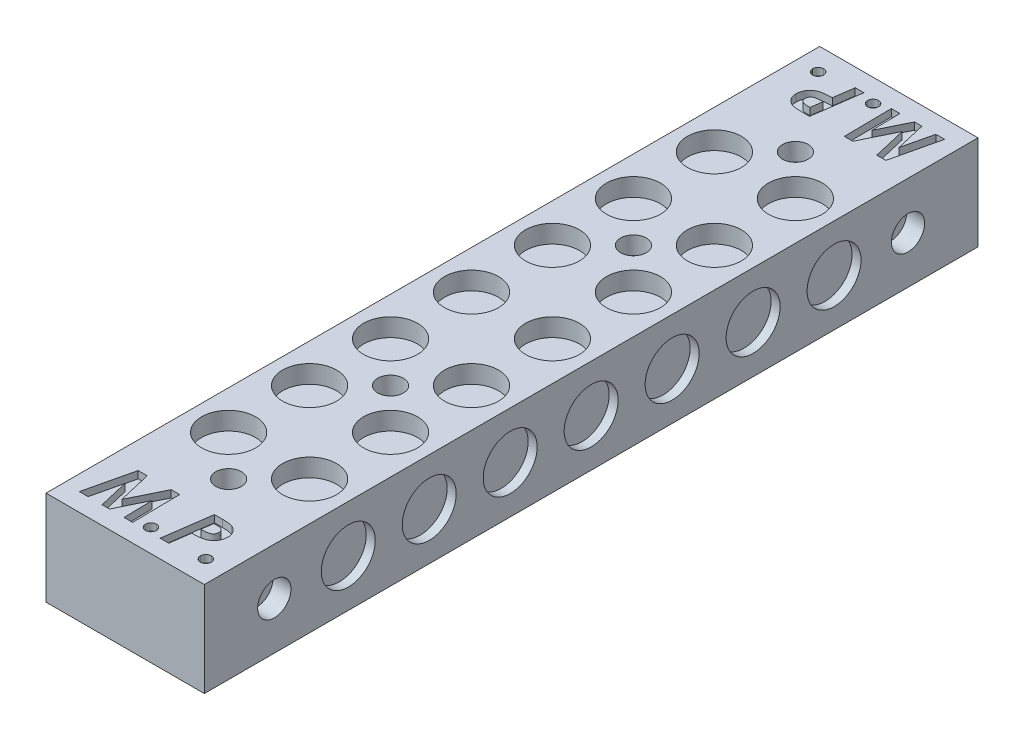
from build123d import *

# Parameters (mm, degrees)
SKETCH1_W           = 17.6
SKETCH1_H           = 86
SKETCH1_R           = 1.425
SKETCH1_R_2         = 3
BOSS_EXTRUDE1_DEPTH = 5.25
CUT_EXTRUDE2_REACH  = 48.758
SKETCH4_R           = 1.85
CUT_EXTRUDE4_REACH  = 48.758
SKETCH4_3_R         = 3
BOSS_EXTRUDE2_START = -10.5
SKETCH5_R           = 1.425
BOSS_EXTRUDE2_DEPTH = 10.5
BOSS_EXTRUDE3_START = -2
BOSS_EXTRUDE3_DEPTH = 6.5
CUT_EXTRUDE6_DEPTH  = 0.8
CIRPATTERN1_COUNT   = 2
CIRPATTERN1_ANGLE   = 180


with BuildPart() as part:
    # Sketch1 → Boss-Extrude1 (new, symmetric)
    with BuildSketch(Plane(origin=(0, 0, 0), x_dir=(1, 0, 0), z_dir=(0, 1, 0))):
        Rectangle(SKETCH1_W, SKETCH1_H)
        with Locations(Location((0, 31.5, 0), (0, 0, 90))):
            Circle(SKETCH1_R, mode=Mode.SUBTRACT)
        with Locations(Location((0, 22.5, 0), (0, 0, 90))):
            Circle(SKETCH1_R, mode=Mode.SUBTRACT)
        with Locations(Location((0, 13.5, 0), (0, 0, 90))):
            Circle(SKETCH1_R, mode=Mode.SUBTRACT)
        with Locations(Location((0, 4.5, 0), (0, 0, 90))):
            Circle(SKETCH1_R, mode=Mode.SUBTRACT)
        with Locations(Location((0, -4.5, 0), (0, 0, 90))):
            Circle(SKETCH1_R, mode=Mode.SUBTRACT)
        with Locations(Location((0, -13.5, 0), (0, 0, 90))):
            Circle(SKETCH1_R, mode=Mode.SUBTRACT)
        with Locations(Location((0, -22.5, 0), (0, 0, 90))):
            Circle(SKETCH1_R, mode=Mode.SUBTRACT)
        with Locations(Location((0, -31.5, 0), (0, 0, 90))):
            Circle(SKETCH1_R, mode=Mode.SUBTRACT)
        with Locations(Location((-4.5, -27, 0), (0, 0, 90))):
            Circle(SKETCH1_R_2, mode=Mode.SUBTRACT)
        with Locations(Location((-4.5, -18, 0), (0, 0, 90))):
            Circle(SKETCH1_R_2, mode=Mode.SUBTRACT)
        with Locations(Location((-4.5, -9, 0), (0, 0, 90))):
            Circle(SKETCH1_R_2, mode=Mode.SUBTRACT)
        with Locations(Location((-4.5, 0, 0), (0, 0, 90))):
            Circle(SKETCH1_R_2, mode=Mode.SUBTRACT)
        with Locations(Location((-4.5, 9, 0), (0, 0, 90))):
            Circle(SKETCH1_R_2, mode=Mode.SUBTRACT)
        with Locations(Location((-4.5, 18, 0), (0, 0, 90))):
            Circle(SKETCH1_R_2, mode=Mode.SUBTRACT)
        with Locations(Location((-4.5, 27, 0), (0, 0, 90))):
            Circle(SKETCH1_R_2, mode=Mode.SUBTRACT)
        with Locations(Location((4.5, 27, 0), (0, 0, 90))):
            Circle(SKETCH1_R_2, mode=Mode.SUBTRACT)
        with Locations(Location((4.5, -27, 0), (0, 0, 90))):
            Circle(SKETCH1_R_2, mode=Mode.SUBTRACT)
        with Locations(Location((4.5, -18, 0), (0, 0, 90))):
            Circle(SKETCH1_R_2, mode=Mode.SUBTRACT)
        with Locations(Location((4.5, -9, 0), (0, 0, 90))):
            Circle(SKETCH1_R_2, mode=Mode.SUBTRACT)
        with Locations(Location((4.5, 0, 0), (0, 0, 90))):
            Circle(SKETCH1_R_2, mode=Mode.SUBTRACT)
        with Locations(Location((4.5, 9, 0), (0, 0, 90))):
            Circle(SKETCH1_R_2, mode=Mode.SUBTRACT)
        with Locations(Location((4.5, 18, 0), (0, 0, 90))):
            Circle(SKETCH1_R_2, mode=Mode.SUBTRACT)
    extrude(amount=BOSS_EXTRUDE1_DEPTH, both=True)

    # Sketch4 → Cut-Extrude2 (cut, up to next)
    with BuildSketch(Plane(origin=(8.8, 0, 0), x_dir=(0, 0, -1), z_dir=(1, 0, 0)), mode=Mode.PRIVATE) as cut_extrude2_sk1:
        with Locations((-35.22, 0)):
            Circle(SKETCH4_R)
    cut_extrude2_tool1 = extrude(cut_extrude2_sk1.sketch, amount=-CUT_EXTRUDE2_REACH, mode=Mode.PRIVATE) & part.part
    # Sketch4 → Cut-Extrude2 (cut, up to next)
    with BuildSketch(Plane(origin=(8.8, 0, 0), x_dir=(0, 0, -1), z_dir=(1, 0, 0)), mode=Mode.PRIVATE) as cut_extrude2_sk2:
        with Locations((35.22, 0)):
            Circle(SKETCH4_R)
    cut_extrude2_tool2 = extrude(cut_extrude2_sk2.sketch, amount=-CUT_EXTRUDE2_REACH, mode=Mode.PRIVATE) & part.part
    add(cut_extrude2_tool1.solids().sort_by_distance((8.8, 0, 35.22))[0], mode=Mode.SUBTRACT)
    add(cut_extrude2_tool2.solids().sort_by_distance((8.8, 0, -35.22))[0], mode=Mode.SUBTRACT)

    # Sketch4<3> → Cut-Extrude4 (cut, up to next)
    with BuildSketch(Plane(origin=(8.8, 0, 0), x_dir=(0, 0, -1), z_dir=(1, 0, 0)), mode=Mode.PRIVATE) as cut_extrude4_sk1:
        with Locations((-27, 0)):
            Circle(SKETCH4_3_R)
    cut_extrude4_tool1 = extrude(cut_extrude4_sk1.sketch, amount=-CUT_EXTRUDE4_REACH, mode=Mode.PRIVATE) & part.part
    # Sketch4<3> → Cut-Extrude4 (cut, up to next)
    with BuildSketch(Plane(origin=(8.8, 0, 0), x_dir=(0, 0, -1), z_dir=(1, 0, 0)), mode=Mode.PRIVATE) as cut_extrude4_sk2:
        with Locations((-18, 0)):
            Circle(SKETCH4_3_R)
    cut_extrude4_tool2 = extrude(cut_extrude4_sk2.sketch, amount=-CUT_EXTRUDE4_REACH, mode=Mode.PRIVATE) & part.part
    # Sketch4<3> → Cut-Extrude4 (cut, up to next)
    with BuildSketch(Plane(origin=(8.8, 0, 0), x_dir=(0, 0, -1), z_dir=(1, 0, 0)), mode=Mode.PRIVATE) as cut_extrude4_sk3:
        with Locations((-9, 0)):
            Circle(SKETCH4_3_R)
    cut_extrude4_tool3 = extrude(cut_extrude4_sk3.sketch, amount=-CUT_EXTRUDE4_REACH, mode=Mode.PRIVATE) & part.part
    # Sketch4<3> → Cut-Extrude4 (cut, up to next)
    with BuildSketch(Plane(origin=(8.8, 0, 0), x_dir=(0, 0, -1), z_dir=(1, 0, 0)), mode=Mode.PRIVATE) as cut_extrude4_sk4:
        Circle(SKETCH4_3_R)
    cut_extrude4_tool4 = extrude(cut_extrude4_sk4.sketch, amount=-CUT_EXTRUDE4_REACH, mode=Mode.PRIVATE) & part.part
    # Sketch4<3> → Cut-Extrude4 (cut, up to next)
    with BuildSketch(Plane(origin=(8.8, 0, 0), x_dir=(0, 0, -1), z_dir=(1, 0, 0)), mode=Mode.PRIVATE) as cut_extrude4_sk5:
        with Locations((9, 0)):
            Circle(SKETCH4_3_R)
    cut_extrude4_tool5 = extrude(cut_extrude4_sk5.sketch, amount=-CUT_EXTRUDE4_REACH, mode=Mode.PRIVATE) & part.part
    # Sketch4<3> → Cut-Extrude4 (cut, up to next)
    with BuildSketch(Plane(origin=(8.8, 0, 0), x_dir=(0, 0, -1), z_dir=(1, 0, 0)), mode=Mode.PRIVATE) as cut_extrude4_sk6:
        with Locations((18, 0)):
            Circle(SKETCH4_3_R)
    cut_extrude4_tool6 = extrude(cut_extrude4_sk6.sketch, amount=-CUT_EXTRUDE4_REACH, mode=Mode.PRIVATE) & part.part
    # Sketch4<3> → Cut-Extrude4 (cut, up to next)
    with BuildSketch(Plane(origin=(8.8, 0, 0), x_dir=(0, 0, -1), z_dir=(1, 0, 0)), mode=Mode.PRIVATE) as cut_extrude4_sk7:
        with Locations((27, 0)):
            Circle(SKETCH4_3_R)
    cut_extrude4_tool7 = extrude(cut_extrude4_sk7.sketch, amount=-CUT_EXTRUDE4_REACH, mode=Mode.PRIVATE) & part.part
    cut_extrude4_1 = cut_extrude4_tool1.solids().sort_by_distance((8.8, 0, 27))[0]
    add(cut_extrude4_1, mode=Mode.SUBTRACT)
    cut_extrude4_2 = cut_extrude4_tool2.solids().sort_by_distance((8.8, 0, 18))[0]
    add(cut_extrude4_2, mode=Mode.SUBTRACT)
    cut_extrude4_3 = cut_extrude4_tool3.solids().sort_by_distance((8.8, 0, 9))[0]
    add(cut_extrude4_3, mode=Mode.SUBTRACT)
    cut_extrude4_4 = cut_extrude4_tool4.solids().sort_by_distance((8.8, 0, 0))[0]
    add(cut_extrude4_4, mode=Mode.SUBTRACT)
    cut_extrude4_5 = cut_extrude4_tool5.solids().sort_by_distance((8.8, 0, -9))[0]
    add(cut_extrude4_5, mode=Mode.SUBTRACT)
    cut_extrude4_6 = cut_extrude4_tool6.solids().sort_by_distance((8.8, 0, -18))[0]
    add(cut_extrude4_6, mode=Mode.SUBTRACT)
    cut_extrude4_7 = cut_extrude4_tool7.solids().sort_by_distance((8.8, 0, -27))[0]
    add(cut_extrude4_7, mode=Mode.SUBTRACT)
    cut_extrude4 = cut_extrude4_1 + cut_extrude4_2 + cut_extrude4_3 + cut_extrude4_4 + cut_extrude4_5 + cut_extrude4_6 + cut_extrude4_7  # Cut-Extrude4 as one shape, for the pattern or mirror that repeats it

    # Mirror3: Cut-Extrude4 across plane
    add(cut_extrude4.mirror(Plane(origin=(0, 0, 0), x_dir=(0, 0, 1), z_dir=(1, 0, 0))), mode=Mode.SUBTRACT)

    # Sketch5 → Boss-Extrude2 (add)
    with BuildSketch(Plane(origin=(0, 5.25, 0), x_dir=(1, 0, 0), z_dir=(0, 1, 0)).offset(BOSS_EXTRUDE2_START)):
        with Locations((0, -22.5)):
            Circle(SKETCH5_R)
        with Locations((0, -4.5)):
            Circle(SKETCH5_R)
        with Locations((0, 4.5)):
            Circle(SKETCH5_R)
        with Locations((0, 22.5)):
            Circle(SKETCH5_R)
    extrude(amount=BOSS_EXTRUDE2_DEPTH)

    # Sketch7 → Boss-Extrude3 (add)
    with BuildSketch(Plane.XZ.offset(5.25).offset(BOSS_EXTRUDE3_START)):
        Polygon((-7.8, -32), (-6.8, -32), (-6.8, -43), (6.8, -43), (6.8, -32), (7.8, -32), (7.8, 32), (6.8, 32), (6.8, 43), (-6.8, 43), (-6.8, 32), (-7.8, 32), align=None)
    extrude(amount=-BOSS_EXTRUDE3_DEPTH)

    # Sketch9 → Cut-Extrude6 (cut)
    # profile 1 of 4: a face of its own
    with BuildSketch(Plane(origin=(0, 5.25, 0), x_dir=(1, 0, 0), z_dir=(0, 1, 0))):
        Polygon((-5.848808093, -35.708333333), (-4.838600093, -35.708333333), (-3.981036325, -39.395115518), (-2.170506143, -35.708333333), (-1.233440171, -35.708333333), (-1.165598291, -41), (-2.115384615, -41), (-2.183226496, -37.83475227), (-3.737229567, -41), (-4.565112513, -41), (-5.337873932, -37.675747863), (-6.119115585, -41), (-7.092222556, -41), align=None)
    # profile 2 of 4: a face of its own
    with BuildSketch(Plane(origin=(0, 5.25, 0), x_dir=(1, 0, 0), z_dir=(0, 1, 0))):
        with BuildLine():
            add(Edge.make_bspline(
                [(0.326923077, -39.846688034), (0.367474829, -39.848437028), (0.447262654, -39.85187827), (0.56137115, -39.887855655), (0.667026619, -39.943864503), (0.759476329, -40.022260945), (0.838324474, -40.114860236), (0.89686432, -40.219695051), (0.930773602, -40.335791585), (0.935218177, -40.416057052), (0.9375, -40.457264957)],
                knots=[0, 0, 0, 0, 1.011829643, 1.990831015, 2.96394547, 3.98733706, 5.003945692, 5.993273531, 6.969756284, 8, 8, 8, 8], degree=3))
            add(Edge.make_bspline(
                [(0.9375, -40.457264957), (0.93515559, -40.497754574), (0.930550481, -40.577288066), (0.896921804, -40.692765191), (0.837978393, -40.797592524), (0.759923571, -40.891305562), (0.666642636, -40.969231036), (0.561902795, -41.027298713), (0.446960546, -41.060918569), (0.367417538, -41.065506311), (0.326923077, -41.06784188)],
                knots=[0, 0, 0, 0, 1.013694729, 1.991193998, 2.981551723, 4.006008661, 5.030465598, 6.008806002, 6.986305271, 8, 8, 8, 8], degree=3))
            add(Edge.make_bspline(
                [(0.326923077, -41.06784188), (0.286084058, -41.065492426), (0.205864139, -41.060877402), (0.090090381, -41.027551387), (-0.014870988, -40.969170343), (-0.108180764, -40.891609851), (-0.185299795, -40.797522839), (-0.242896926, -40.69249252), (-0.276763204, -40.57731624), (-0.281329298, -40.497764078), (-0.283653846, -40.457264957)],
                knots=[0, 0, 0, 0, 1.02155614, 2.006638561, 2.984070978, 4.007577129, 5.025452526, 6.010654007, 6.987246069, 8, 8, 8, 8], degree=3))
            add(Edge.make_bspline(
                [(-0.283653846, -40.457264957), (-0.281392423, -40.416047336), (-0.276987584, -40.335762942), (-0.242839317, -40.219967243), (-0.185643871, -40.114935146), (-0.107732558, -40.021952702), (-0.015254456, -39.943927112), (0.090621124, -39.88760313), (0.205563446, -39.851917123), (0.286026851, -39.848450152), (0.326923077, -39.846688034)],
                knots=[0, 0, 0, 0, 1.029295292, 2.004879113, 2.989063463, 3.999073543, 5.021523017, 5.993741641, 6.980301721, 8, 8, 8, 8], degree=3))
        make_face()
    # profile 3 of 4: a face of its own
    with BuildSketch(Plane(origin=(0, 5.25, 0), x_dir=(1, 0, 0), z_dir=(0, 1, 0))):
        with BuildLine():
            Line((2.629306891, -35.708333333), (3.534571982, -35.708333333))
            add(Edge.make_bspline(
                [(3.534571982, -35.708333333), (3.600656175, -35.708602478), (3.727923609, -35.709120806), (3.91136645, -35.716891255), (4.080020866, -35.728164628), (4.233470528, -35.743952635), (4.371684748, -35.763172455), (4.494258792, -35.789265491), (4.60273656, -35.817086524), (4.667959819, -35.843374615), (4.698484241, -35.855677417)],
                knots=[0, 0, 0, 0, 1.344208059, 2.588726621, 3.734329264, 4.782131975, 5.726482068, 6.570895881, 7.331180631, 8, 8, 8, 8], degree=3))
            add(Edge.make_bspline(
                [(4.698484241, -35.855677417), (4.732643973, -35.871090703), (4.79997519, -35.901471366), (4.895107764, -35.954615517), (4.983674092, -36.012425571), (5.066506171, -36.073624269), (5.142997924, -36.139555142), (5.213594367, -36.209687506), (5.277033404, -36.285160271), (5.334570538, -36.36481781), (5.385196843, -36.448674256), (5.430178569, -36.535523325), (5.466989165, -36.62620901), (5.498356451, -36.719833163), (5.521316431, -36.817864912), (5.537964362, -36.919157209), (5.549318195, -37.023927737), (5.55026574, -37.094821198), (5.550747863, -37.130892762)],
                knots=[0, 0, 0, 0, 1.101151138, 2.170445781, 3.198860437, 4.208379212, 5.195204417, 6.164605257, 7.130047863, 8.089887807, 9.049952485, 10.006809717, 10.961522665, 11.923831799, 12.906274987, 13.917075149, 14.940179313, 16, 16, 16, 16], degree=3))
            add(Edge.make_bspline(
                [(5.550747863, -37.130892762), (5.549841568, -37.170492326), (5.548041293, -37.249153395), (5.536463983, -37.365424218), (5.516229724, -37.478837897), (5.487158453, -37.58916291), (5.451623191, -37.697553946), (5.406557492, -37.802467735), (5.354827231, -37.904881426), (5.294027343, -38.002791295), (5.228214907, -38.097145011), (5.154470944, -38.184129578), (5.075885156, -38.264522801), (4.992871966, -38.340084564), (4.902633585, -38.406904054), (4.808332311, -38.469182471), (4.707730761, -38.523230659), (4.600378261, -38.571932347), (4.480489137, -38.613923367), (4.345127085, -38.650420744), (4.19149005, -38.682090807), (4.020188715, -38.707956302), (3.83065382, -38.729146953), (3.62341585, -38.744218983), (3.397952925, -38.756413983), (3.241667458, -38.759574255), (3.160381611, -38.761217949)],
                knots=[0, 0, 0, 0, 0.866399648, 1.721027061, 2.553550129, 3.384204618, 4.21539855, 5.04677222, 5.880012857, 6.723270778, 7.566245156, 8.394738354, 9.214784533, 10.025005932, 10.847562629, 11.668810448, 12.495570546, 13.343317016, 14.245569203, 15.271435576, 16.408570332, 17.675782105, 19.060520395, 20.580184572, 22.221315141, 24, 24, 24, 24], degree=3))
            Line((3.160381611, -38.761217949), (2.845552885, -41))
            Line((2.845552885, -41), (1.887286325, -41))
            Line((1.887286325, -41), (2.629306891, -35.708333333))
        make_face()
        with BuildLine():
            add(Edge.make_bspline(
                [(3.283345019, -37.879273504), (3.348718956, -37.878161965), (3.47315999, -37.87604612), (3.651091741, -37.868325772), (3.811275459, -37.853385201), (3.954009823, -37.834044631), (4.079015451, -37.808619669), (4.186722388, -37.779055285), (4.276240083, -37.742023422), (4.35035463, -37.700283504), (4.409168749, -37.650583604), (4.461295601, -37.59848455), (4.504881812, -37.539951983), (4.539905229, -37.475512118), (4.567916044, -37.406279365), (4.586640996, -37.330978019), (4.598420392, -37.250693866), (4.600102666, -37.195243513), (4.600961538, -37.166933761)],
                knots=[0, 0, 0, 0, 1.839895187, 3.502289619, 5.0101303, 6.365671836, 7.553232357, 8.598057788, 9.502875839, 10.27370316, 10.980290013, 11.662314044, 12.34441055, 13.025273935, 13.721358838, 14.440015487, 15.203561875, 16, 16, 16, 16], degree=3))
            add(Edge.make_bspline(
                [(4.600961538, -37.166933761), (4.59967533, -37.135415128), (4.597167495, -37.073960452), (4.579657673, -36.985603836), (4.54776495, -36.905475244), (4.505805853, -36.832810281), (4.450662828, -36.769349094), (4.384061407, -36.715632919), (4.305306181, -36.673058272), (4.230392642, -36.646816676), (4.16078955, -36.63006692), (4.095492658, -36.620146716), (4.018831835, -36.61045856), (3.930370245, -36.603616686), (3.830749964, -36.596960124), (3.719046944, -36.592929169), (3.595706659, -36.591123977), (3.509485153, -36.590567437), (3.464610043, -36.590277778)],
                knots=[0, 0, 0, 0, 1.03742853, 2.022766538, 2.947121861, 3.864647693, 4.771646501, 5.697975149, 6.666071958, 7.703435297, 8.301453266, 9.020359131, 9.87578453, 10.844509861, 11.939964187, 13.162010635, 14.522931311, 16, 16, 16, 16], degree=3))
            Line((3.464610043, -36.590277778), (3.283345019, -37.879273504))
        make_face(mode=Mode.SUBTRACT)
    # profile 4 of 4: a face of its own
    with BuildSketch(Plane(origin=(0, 5.25, 0), x_dir=(1, 0, 0), z_dir=(0, 1, 0))):
        with BuildLine():
            add(Edge.make_bspline(
                [(6.432692308, -39.846688034), (6.47324406, -39.848437028), (6.553031885, -39.85187827), (6.667140381, -39.887855655), (6.772795849, -39.943864503), (6.86524556, -40.022260945), (6.944093705, -40.114860236), (7.00263355, -40.219695051), (7.036542833, -40.335791585), (7.040987407, -40.416057052), (7.043269231, -40.457264957)],
                knots=[0, 0, 0, 0, 1.011829643, 1.990831015, 2.96394547, 3.98733706, 5.003945692, 5.993273531, 6.969756284, 8, 8, 8, 8], degree=3))
            add(Edge.make_bspline(
                [(7.043269231, -40.457264957), (7.040924821, -40.497754574), (7.036319711, -40.577288066), (7.002691035, -40.692765191), (6.943747624, -40.797592524), (6.865692802, -40.891305562), (6.772411867, -40.969231036), (6.667672026, -41.027298713), (6.552729777, -41.060918569), (6.473186769, -41.065506311), (6.432692308, -41.06784188)],
                knots=[0, 0, 0, 0, 1.013694729, 1.991193998, 2.981551723, 4.006008661, 5.030465598, 6.008806002, 6.986305271, 8, 8, 8, 8], degree=3))
            add(Edge.make_bspline(
                [(6.432692308, -41.06784188), (6.391853289, -41.065492426), (6.31163337, -41.060877402), (6.195859611, -41.027551387), (6.090898243, -40.969170343), (5.997588467, -40.891609851), (5.920469436, -40.797522839), (5.862872304, -40.69249252), (5.829006027, -40.57731624), (5.824439932, -40.497764078), (5.822115385, -40.457264957)],
                knots=[0, 0, 0, 0, 1.02155614, 2.006638561, 2.984070978, 4.007577129, 5.025452526, 6.010654007, 6.987246069, 8, 8, 8, 8], degree=3))
            add(Edge.make_bspline(
                [(5.822115385, -40.457264957), (5.824376808, -40.416047336), (5.828781647, -40.335762942), (5.862929913, -40.219967243), (5.92012536, -40.114935146), (5.998036673, -40.021952702), (6.090514775, -39.943927112), (6.196390355, -39.88760313), (6.311332677, -39.851917123), (6.391796082, -39.848450152), (6.432692308, -39.846688034)],
                knots=[0, 0, 0, 0, 1.029295292, 2.004879113, 2.989063463, 3.999073543, 5.021523017, 5.993741641, 6.980301721, 8, 8, 8, 8], degree=3))
        make_face()
    cut_extrude6 = extrude(amount=-CUT_EXTRUDE6_DEPTH, mode=Mode.SUBTRACT)

    # CirPattern1: Cut-Extrude6 ×2 about axis
    cirpattern1_axis = Axis((0, 5.775, 0), (0, -1, 0))
    for i in range(1, CIRPATTERN1_COUNT):
        add(cut_extrude6.rotate(cirpattern1_axis, i * CIRPATTERN1_ANGLE / (CIRPATTERN1_COUNT - 1)), mode=Mode.SUBTRACT)


solid = part.part
